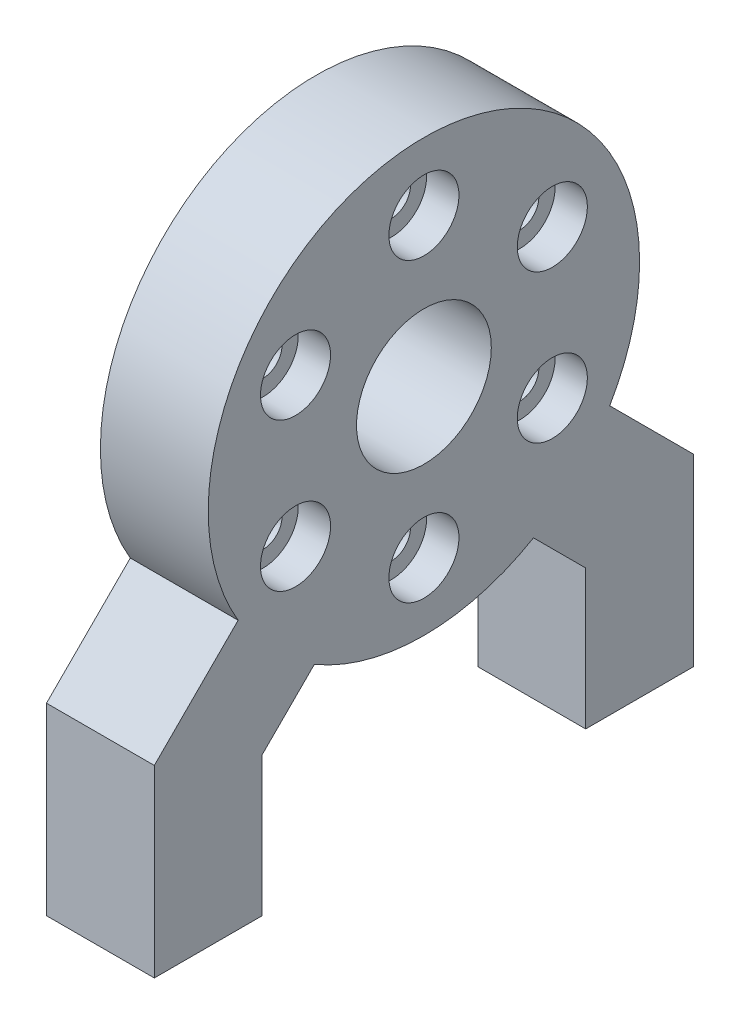
from build123d import *

# Parameters (mm, degrees)
CROQUIS1_R              = 20
CROQUIS1_R_2            = 6.25
CROQUIS1_R_3            = 1.75
SALIENTE_EXTRUIR1_DEPTH = 5
SALIENTE_EXTRUIR2_DEPTH = 5
CROQUIS3_R              = 3.25
CORTAR_EXTRUIR1_DEPTH   = 3
CROQUIS4_R              = 2.5
CORTAR_EXTRUIR2_DEPTH   = 10


with BuildPart() as part:
    # Croquis1 → Saliente-Extruir1 (new, symmetric)
    with BuildSketch(Plane(origin=(0, 0, 0), x_dir=(0, 0, -1), z_dir=(1, 0, 0))):
        Circle(CROQUIS1_R)
        Circle(CROQUIS1_R_2, mode=Mode.SUBTRACT)
        with Locations((0, 13.75)):
            Circle(CROQUIS1_R_3, mode=Mode.SUBTRACT)
        with Locations((11.907849302, 6.875)):
            Circle(CROQUIS1_R_3, mode=Mode.SUBTRACT)
        with Locations((11.907849302, -6.875)):
            Circle(CROQUIS1_R_3, mode=Mode.SUBTRACT)
        with Locations((0, -13.75)):
            Circle(CROQUIS1_R_3, mode=Mode.SUBTRACT)
        with Locations((-11.907849302, -6.875)):
            Circle(CROQUIS1_R_3, mode=Mode.SUBTRACT)
        with Locations((-11.907849302, 6.875)):
            Circle(CROQUIS1_R_3, mode=Mode.SUBTRACT)
    extrude(amount=SALIENTE_EXTRUIR1_DEPTH, both=True)

    # Croquis2 → Saliente-Extruir2 (add, symmetric)
    with BuildSketch(Plane(origin=(0, 0, 0), x_dir=(0, 0, -1), z_dir=(1, 0, 0))):
        with BuildLine():
            Line((-15, -35), (-25, -35))
            Line((-25, -35), (-25, -17.928932188))
            Line((-25, -17.928932188), (-17.228597844, -10.157530032))
            ThreePointArc((-17.228597844, -10.157530032), (-14.142135624, -14.142135624), (-10.157530032, -17.228597844))
            Line((-10.157530032, -17.228597844), (-15, -22.071067812))
            Line((-15, -22.071067812), (-15, -35))
        make_face()
        with BuildLine():
            Line((15, -35), (15, -22.071067812))
            Line((15, -22.071067812), (10.157530032, -17.228597844))
            ThreePointArc((10.157530032, -17.228597844), (14.142135624, -14.142135624), (17.228597844, -10.157530032))
            Line((17.228597844, -10.157530032), (25, -17.928932188))
            Line((25, -17.928932188), (25, -35))
            Line((25, -35), (15, -35))
        make_face()
    extrude(amount=SALIENTE_EXTRUIR2_DEPTH, both=True)

    # Croquis3 → Cortar-Extruir1 (cut)
    with BuildSketch(Plane(origin=(5, 0, 0), x_dir=(0, 0, -1), z_dir=(1, 0, 0))):
        with Locations((0, 13.75)):
            Circle(CROQUIS3_R)
        with Locations((11.907849302, 6.875)):
            Circle(CROQUIS3_R)
        with Locations((11.907849302, -6.875)):
            Circle(CROQUIS3_R)
        with Locations((0, -13.75)):
            Circle(CROQUIS3_R)
        with Locations((-11.907849302, -6.875)):
            Circle(CROQUIS3_R)
        with Locations((-11.907849302, 6.875)):
            Circle(CROQUIS3_R)
    extrude(amount=-CORTAR_EXTRUIR1_DEPTH, mode=Mode.SUBTRACT)

    # Croquis4 → Cortar-Extruir2 (cut)
    with BuildSketch(Plane.XZ.offset(35)):
        with Locations(Location((0, 20, 0), (0, 0, 270))):
            Circle(CROQUIS4_R)
        with Locations(Location((0, -20, 0), (0, 0, 270))):
            Circle(CROQUIS4_R)
    extrude(amount=-CORTAR_EXTRUIR2_DEPTH, mode=Mode.SUBTRACT)


solid = part.part
